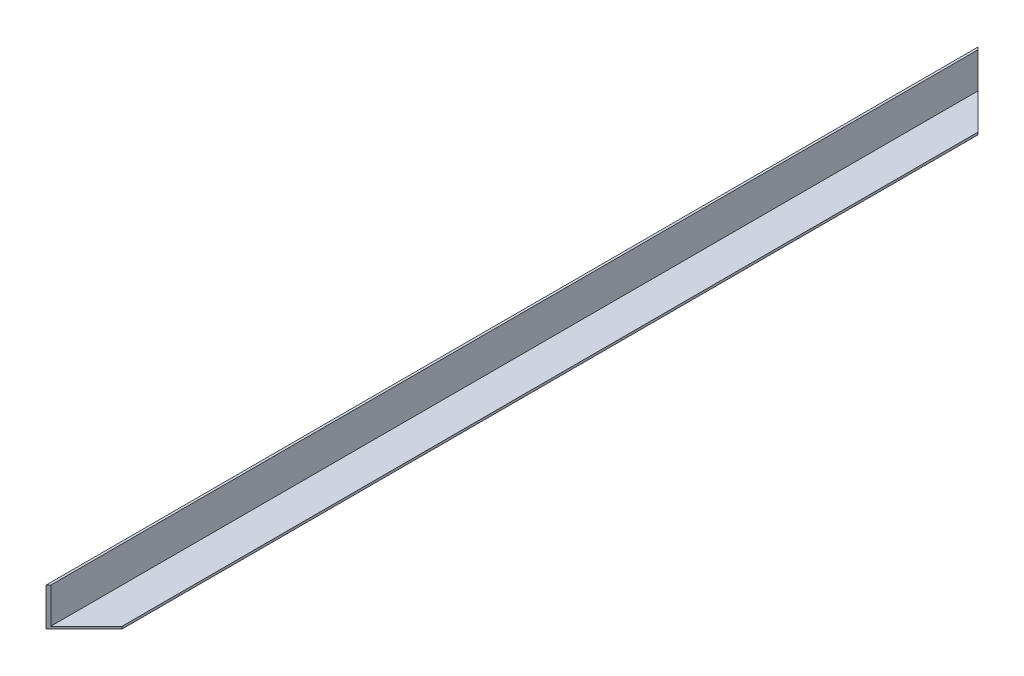
from build123d import *

# Parameters (mm, degrees)
EXTRUDE_THIN1_DEPTH = 392
CUT_EXTRUDE1_DEPTH  = 393.613041047


with BuildPart() as part:
    # Sketch1 → Extrude-Thin1 (new body)
    with BuildSketch(Plane.XY):
        Polygon((15, 0), (0, 0), (0, 15), (-1, 15), (-1, -1), (15, -1), align=None)
    extrude(amount=EXTRUDE_THIN1_DEPTH)

    # Sketch2 → Cut-Extrude1 (cut, through all)
    with BuildSketch(Plane.XZ.offset(1)):
        Polygon((-1, 392), (15, 376), (15, 392), align=None)
        Polygon((15, 16), (15, 0), (-1, 0), align=None)
    extrude(amount=-CUT_EXTRUDE1_DEPTH, mode=Mode.SUBTRACT)


solid = part.part
